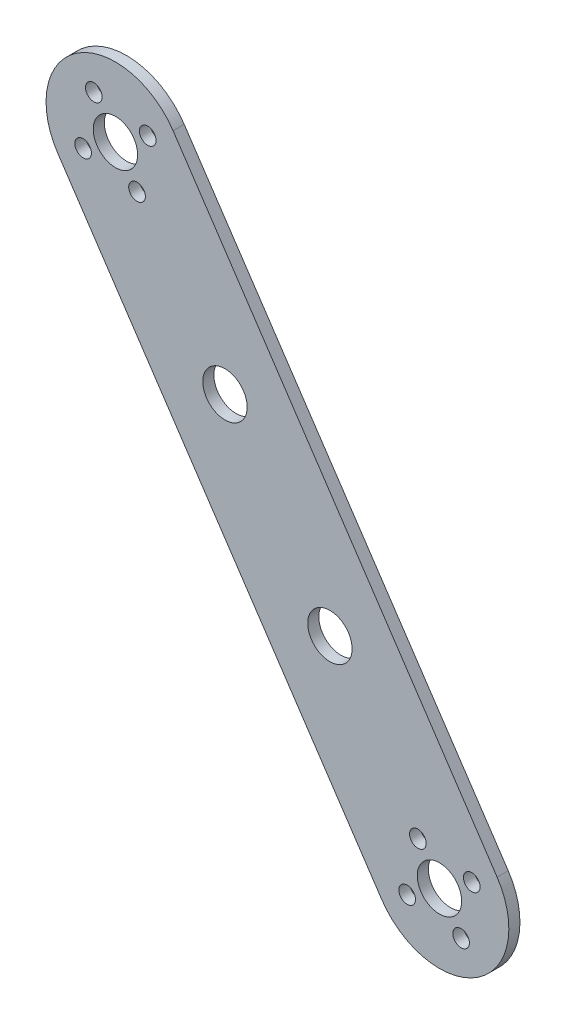
from build123d import *

# Parameters (mm, degrees)
SKETCH_1_R      = 1.5
SKETCH_1_R_2    = 4
EXTRUDE_1_DEPTH = 2


with BuildPart() as part:
    # 草图1 → 凸台-拉伸1 (new body)
    with BuildSketch(Plane.XY):
        with BuildLine():
            Line((-61.488767219, 124.724881113), (-3.110114112, 37.449839656))
            ThreePointArc((-3.110114112, 37.449839656), (-6.550160344, 20.110114112), (-23.889885888, 23.550160344))
            Line((-23.889885888, 23.550160344), (-82.268538994, 110.825201802))
            ThreePointArc((-82.268538994, 110.825201802), (-78.828492762, 128.164927346), (-61.488767219, 124.724881113))
        make_face()
        with Locations((-66.060317009, 121.666951665)):
            Circle(SKETCH_1_R, mode=Mode.SUBTRACT)
        with Locations((-75.770563314, 123.593377555)):
            Circle(SKETCH_1_R, mode=Mode.SUBTRACT)
        with Locations((-67.986742899, 111.956705361)):
            Circle(SKETCH_1_R, mode=Mode.SUBTRACT)
        with Locations((-71.878653107, 117.775041458)):
            Circle(SKETCH_1_R_2, mode=Mode.SUBTRACT)
        with Locations((-77.696989204, 113.883131251)):
            Circle(SKETCH_1_R, mode=Mode.SUBTRACT)
        with Locations((-19.318336097, 26.608089793)):
            Circle(SKETCH_1_R, mode=Mode.SUBTRACT)
        with Locations((-9.608089793, 24.681663903)):
            Circle(SKETCH_1_R, mode=Mode.SUBTRACT)
        with Locations((-17.391910207, 36.318336097)):
            Circle(SKETCH_1_R, mode=Mode.SUBTRACT)
        with Locations((-13.5, 30.5)):
            Circle(SKETCH_1_R_2, mode=Mode.SUBTRACT)
        with Locations((-7.681663903, 34.391910207)):
            Circle(SKETCH_1_R, mode=Mode.SUBTRACT)
        with Locations((-52.141108485, 88.267765536)):
            Circle(SKETCH_1_R_2, mode=Mode.SUBTRACT)
        with Locations((-33.237544622, 60.007275921)):
            Circle(SKETCH_1_R_2, mode=Mode.SUBTRACT)
    extrude(amount=EXTRUDE_1_DEPTH)


solid = part.part
